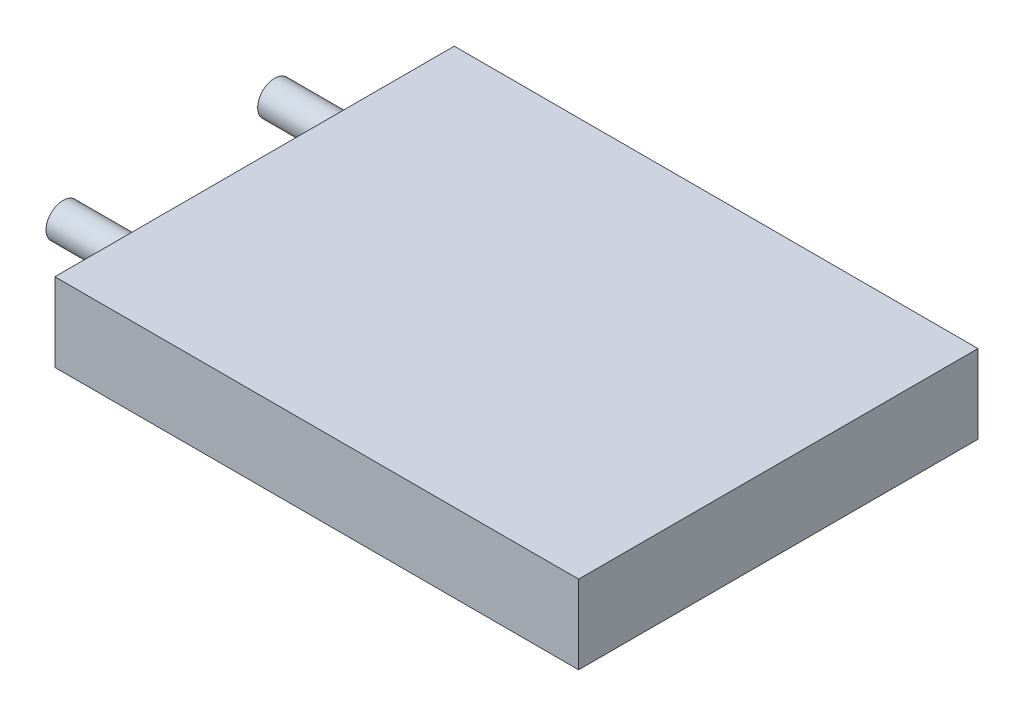
from build123d import *

# Parameters (mm, degrees)
SKETCH1_W           = 80
SKETCH1_H           = 61
BOSS_EXTRUDE1_DEPTH = 12
SKETCH2_R           = 2.592161368
BOSS_EXTRUDE2_DEPTH = 12.5


with BuildPart() as part:
    # Sketch1 → Boss-Extrude1 (new body)
    with BuildSketch(Plane(origin=(0, 0, 0), x_dir=(1, 0, 0), z_dir=(0, 1, 0))):
        Rectangle(SKETCH1_W, SKETCH1_H)
    extrude(amount=BOSS_EXTRUDE1_DEPTH)

    # Sketch2 → Boss-Extrude2 (add)
    with BuildSketch(Plane.ZY.offset(40)):
        with Locations((-15.567073505, 6.384900169)):
            Circle(SKETCH2_R)
        with Locations((16.764540698, 6.384900169)):
            Circle(SKETCH2_R)
    extrude(amount=BOSS_EXTRUDE2_DEPTH)


solid = part.part
